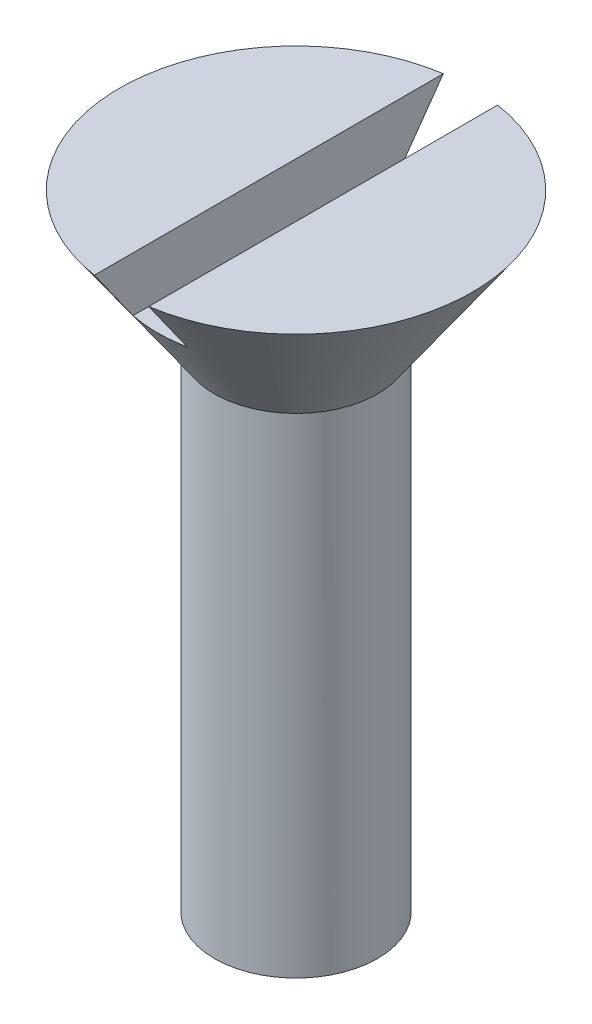
from build123d import *

# Parameters (mm, degrees)
CUT_EXTRUDE1_DEPTH      = 25.768932153
CUT_EXTRUDE1_DEPTH_BACK = 25.768932153
SKETCH1_3_W             = 2
SKETCH1_3_H             = 2


with BuildPart() as part:
    # Sketch1 → Revolve1 (revolve)
    with BuildSketch(Plane.XY):
        Polygon((0, -1.732050808), (3, 0), (3, 18), (6.5, 23), (0, 23), align=None)
    revolve(axis=Axis((0, 18, 0), (0, 1, 0)))

    # Sketch1<3> → Cut-Extrude1 (cut, two sides: drawn at the far end of the back side and taken through both)
    with BuildSketch(Plane.XY.offset(-CUT_EXTRUDE1_DEPTH_BACK)):
        with Locations((0, 22)):
            Rectangle(SKETCH1_3_W, SKETCH1_3_H)
    extrude(amount=CUT_EXTRUDE1_DEPTH + CUT_EXTRUDE1_DEPTH_BACK, mode=Mode.SUBTRACT)


solid = part.part
